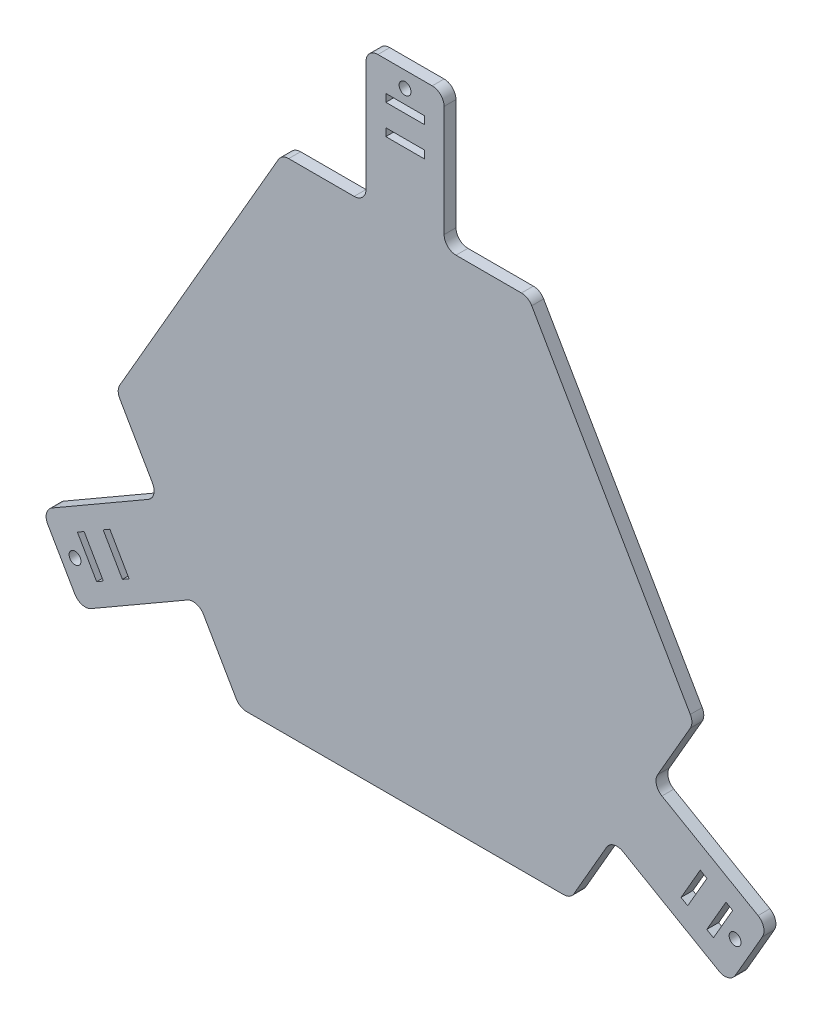
from build123d import *

# Parameters (mm, degrees)
SKETCH_1_R      = 1.5
SKETCH_1_W      = 9.7
SKETCH_1_H      = 1.95
EXTRUDE_3_DEPTH = 3


with BuildPart() as part:
    # Эскиз1 → Бобышка-Вытянуть3 (new body)
    with BuildSketch(Plane.XY):
        with BuildLine():
            Line((-88.837912602, -46.410254038), (-84.611415294, -53.730762114))
            Line((-84.611415294, -53.730762114), (-83.299663948, -56.002782092))
            ThreePointArc((-83.299663948, -56.002782092), (-81.478044872, -57.40055957), (-79.201587737, -57.100858303))
            Line((-79.201587737, -57.100858303), (-54.952876431, -43.100858303))
            ThreePointArc((-54.952876431, -43.100858303), (-52.676419295, -42.801157035), (-50.854800219, -44.198934514))
            Line((-50.854800219, -44.198934514), (-42.598076211, -58.5))
            ThreePointArc((-42.598076211, -58.5), (-41.5, -59.598076211), (-40, -60))
            Line((-40, -60), (40, -60))
            ThreePointArc((40, -60), (41.5, -59.598076211), (42.598076211, -58.5))
            Line((42.598076211, -58.5), (50.854800219, -44.198934514))
            ThreePointArc((50.854800219, -44.198934514), (52.676419295, -42.801157035), (54.952876431, -43.100858303))
            Line((54.952876431, -43.100858303), (79.201587737, -57.100858303))
            ThreePointArc((79.201587737, -57.100858303), (81.478044872, -57.40055957), (83.299663948, -56.002782092))
            Line((83.299663948, -56.002782092), (84.611415294, -53.730762114))
            Line((84.611415294, -53.730762114), (88.837912602, -46.410254038))
            Line((88.837912602, -46.410254038), (90.149663948, -44.13823406))
            ThreePointArc((90.149663948, -44.13823406), (90.449365215, -41.861776924), (89.051587737, -40.040157848))
            Line((89.051587737, -40.040157848), (64.802876431, -26.040157848))
            ThreePointArc((64.802876431, -26.040157848), (63.405098952, -24.218538772), (63.704800219, -21.942081637))
            Line((63.704800219, -21.942081637), (71.961524227, -7.641016151))
            ThreePointArc((71.961524227, -7.641016151), (72.363448016, -6.141016151), (71.961524227, -4.641016151))
            Line((71.961524227, -4.641016151), (31.961524227, 64.641016151))
            ThreePointArc((31.961524227, 64.641016151), (30.863448016, 65.739092363), (29.363448016, 66.141016151))
            Line((29.363448016, 66.141016151), (12.85, 66.141016151))
            ThreePointArc((12.85, 66.141016151), (10.728679656, 67.019695808), (9.85, 69.141016151))
            Line((9.85, 69.141016151), (9.85, 97.141016151))
            ThreePointArc((9.85, 97.141016151), (8.971320344, 99.262336495), (6.85, 100.141016151))
            Line((6.85, 100.141016151), (4.226497308, 100.141016151))
            Line((4.226497308, 100.141016151), (-4.226497308, 100.141016151))
            Line((-4.226497308, 100.141016151), (-6.85, 100.141016151))
            ThreePointArc((-6.85, 100.141016151), (-8.971320344, 99.262336495), (-9.85, 97.141016151))
            Line((-9.85, 97.141016151), (-9.85, 69.141016151))
            ThreePointArc((-9.85, 69.141016151), (-10.728679656, 67.019695808), (-12.85, 66.141016151))
            Line((-12.85, 66.141016151), (-29.363448016, 66.141016151))
            ThreePointArc((-29.363448016, 66.141016151), (-30.863448016, 65.739092363), (-31.961524227, 64.641016151))
            Line((-31.961524227, 64.641016151), (-71.961524227, -4.641016151))
            ThreePointArc((-71.961524227, -4.641016151), (-72.363448016, -6.141016151), (-71.961524227, -7.641016151))
            Line((-71.961524227, -7.641016151), (-63.704800219, -21.942081637))
            ThreePointArc((-63.704800219, -21.942081637), (-63.405098952, -24.218538772), (-64.802876431, -26.040157848))
            Line((-64.802876431, -26.040157848), (-89.051587737, -40.040157848))
            ThreePointArc((-89.051587737, -40.040157848), (-90.449365215, -41.861776924), (-90.149663948, -44.13823406))
            Line((-90.149663948, -44.13823406), (-88.837912602, -46.410254038))
        make_face()
        with Locations((-83.260562333, -48.070508076)):
            Circle(SKETCH_1_R, mode=Mode.SUBTRACT)
        with Locations(Location((83.260562333, -48.070508076, 0), (0, 0, 180))):
            Circle(SKETCH_1_R, mode=Mode.SUBTRACT)
        with Locations((0, 96.141016151)):
            Circle(SKETCH_1_R, mode=Mode.SUBTRACT)
        Polygon((-77.804473419, -50.520731284), (-82.654473419, -42.120284867), (-80.965723882, -41.145284867), (-76.115723882, -49.545731284), align=None, mode=Mode.SUBTRACT)
        Polygon((-71.309282891, -46.770731284), (-76.159282891, -38.370284867), (-74.470533354, -37.395284867), (-69.620533354, -45.795731284), align=None, mode=Mode.SUBTRACT)
        Polygon((69.620533354, -45.795731284), (74.470533354, -37.395284867), (76.159282891, -38.370284867), (71.309282891, -46.770731284), align=None, mode=Mode.SUBTRACT)
        Polygon((76.115723882, -49.545731284), (80.965723882, -41.145284867), (82.654473419, -42.120284867), (77.804473419, -50.520731284), align=None, mode=Mode.SUBTRACT)
        with Locations((0, 91.666016151)):
            Rectangle(SKETCH_1_W, SKETCH_1_H, mode=Mode.SUBTRACT)
        with Locations((0, 84.166016151)):
            Rectangle(SKETCH_1_W, SKETCH_1_H, mode=Mode.SUBTRACT)
    extrude(amount=EXTRUDE_3_DEPTH)


solid = part.part
